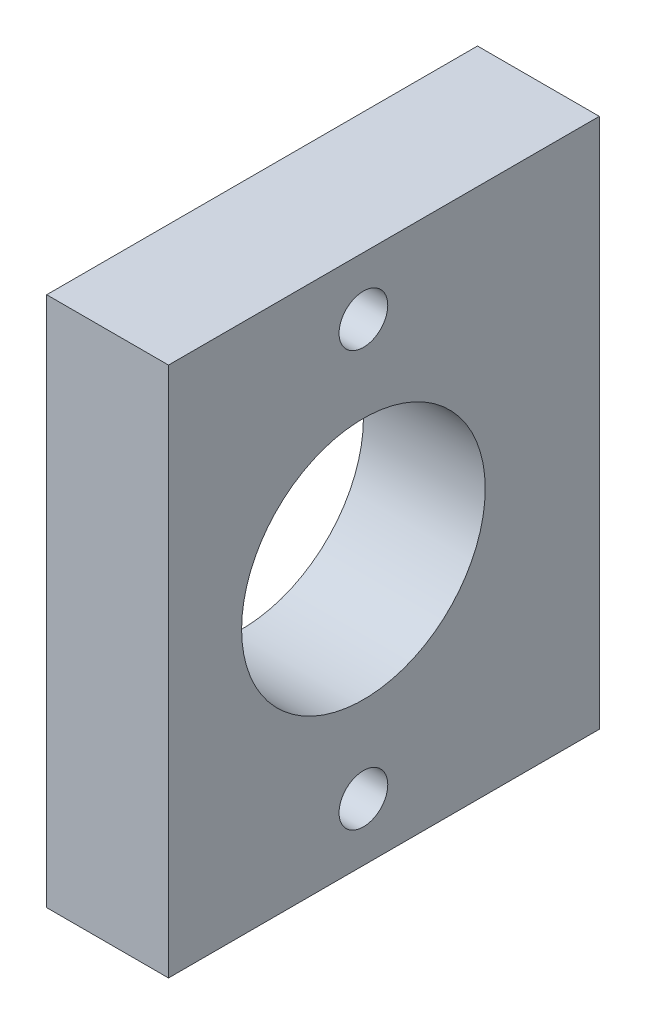
from build123d import *

# Parameters (mm, degrees)
SKETCH1_W           = 17.68268103
SKETCH1_H           = 21.787737723
SKETCH1_R           = 5
SKETCH1_R_2         = 1
BOSS_EXTRUDE1_DEPTH = 5


with BuildPart() as part:
    # Sketch1 → Boss-Extrude1 (new body)
    with BuildSketch(Plane(origin=(86.099724888, 0, 0), x_dir=(0, 0, -1), z_dir=(1, 0, 0))):
        with Locations((-103.174965701, 42.109927869)):
            Rectangle(SKETCH1_W, SKETCH1_H)
        with Locations((-104.016306216, 42.109927869)):
            Circle(SKETCH1_R, mode=Mode.SUBTRACT)
        with Locations((-104.016306216, 50.63202404)):
            Circle(SKETCH1_R_2, mode=Mode.SUBTRACT)
        with Locations((-104.016306216, 33.587831698)):
            Circle(SKETCH1_R_2, mode=Mode.SUBTRACT)
    extrude(amount=BOSS_EXTRUDE1_DEPTH)


solid = part.part
